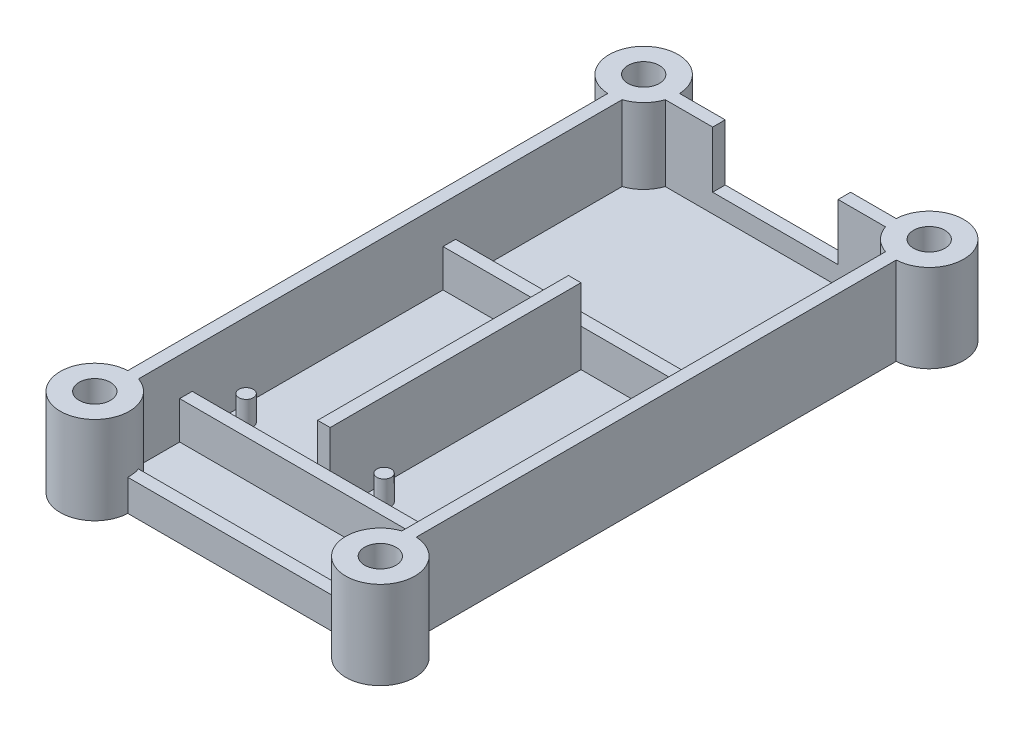
from build123d import *

# Parameters (mm, degrees)
SKETCH1_R              = 6.985
SKETCH1_R_2            = 3.175
SKETCH1_W              = 2.54
SKETCH1_H              = 50.8
BOSS_EXTRUDE1_DEPTH    = 17.78
SKETCH25_W             = 25.4
SKETCH25_H             = 50.8
SKETCH25_R             = 1.4605
BOSS_EXTRUDE10_DEPTH   = 2.54
BOSS_EXTRUDE10_2_DEPTH = 2.54
BOSS_EXTRUDE10_3_DEPTH = 2.54
BOSS_EXTRUDE10_4_DEPTH = 2.54
SKETCH16_R             = 1.4605
BOSS_EXTRUDE8_DEPTH    = 7.62
BOSS_EXTRUDE8_2_DEPTH  = 7.62
BOSS_EXTRUDE8_3_DEPTH  = 7.62
BOSS_EXTRUDE8_4_DEPTH  = 7.62
SKETCH17_W             = 53.34
SKETCH17_H             = 2.54
BOSS_EXTRUDE9_DEPTH    = 10.16
BOSS_EXTRUDE9_2_DEPTH  = 10.16
BOSS_EXTRUDE11_DEPTH   = 6.35
SKETCH20_W             = 25.4
SKETCH20_H             = 11.43
CUT_EXTRUDE7_DEPTH     = 2.54


with BuildPart() as part:
    # Sketch1 → Boss-Extrude1 (new body)
    # profile 1 of 12: a face of its own
    with BuildSketch(Plane(origin=(0, 0, 0), x_dir=(1, 0, 0), z_dir=(0, 1, 0))):
        with Locations((-28.91506403, -42.88506403)):
            Circle(SKETCH1_R)
        with Locations(Location((-28.91506403, -42.88506403, 0), (0, 0, 270))):
            Circle(SKETCH1_R_2, mode=Mode.SUBTRACT)
    # profile 2 of 12: a face of its own
    with BuildSketch(Plane(origin=(0, 0, 0), x_dir=(1, 0, 0), z_dir=(0, 1, 0))):
        with BuildLine():
            Line((-26.67, -36.270692367), (-26.67, -27.94))
            Line((-26.67, -27.94), (-29.21, -27.94))
            Line((-29.21, -27.94), (-29.21, -35.906293524))
            ThreePointArc((-29.21, -35.906293524), (-27.92312326, -35.970855579), (-26.67, -36.270692367))
        make_face()
    # profile 3 of 12: a face of its own
    with BuildSketch(Plane(origin=(0, 0, 0), x_dir=(1, 0, 0), z_dir=(0, 1, 0))):
        Polygon((-26.67, -27.94), (-26.67, -25.4), (-26.67, 25.4), (-26.67, 27.94), (-29.21, 27.94), (-29.21, -27.94), align=None)
    # profile 4 of 12: a face of its own
    with BuildSketch(Plane(origin=(0, 0, 0), x_dir=(1, 0, 0), z_dir=(0, 1, 0))):
        Polygon((26.67, -25.4), (26.67, -27.94), (29.21, -27.94), (29.21, 27.94), (26.67, 27.94), (26.67, 25.4), align=None)
    # profile 5 of 12: a face of its own
    with BuildSketch(Plane(origin=(0, 0, 0), x_dir=(1, 0, 0), z_dir=(0, 1, 0))):
        with BuildLine():
            Line((29.21, -27.94), (26.67, -27.94))
            Line((26.67, -27.94), (26.67, -36.270692367))
            ThreePointArc((26.67, -36.270692367), (27.92312326, -35.970855579), (29.21, -35.906293524))
            Line((29.21, -35.906293524), (29.21, -27.94))
        make_face()
    # profile 6 of 12: a face of its own
    with BuildSketch(Plane(origin=(0, 0, 0), x_dir=(1, 0, 0), z_dir=(0, 1, 0))):
        with Locations((28.91506403, -42.88506403)):
            Circle(SKETCH1_R)
        with Locations(Location((28.91506403, -42.88506403, 0), (0, 0, 270))):
            Circle(SKETCH1_R_2, mode=Mode.SUBTRACT)
    # profile 7 of 12: a face of its own
    with BuildSketch(Plane(origin=(0, 0, 0), x_dir=(1, 0, 0), z_dir=(0, 1, 0))):
        with BuildLine():
            Line((-29.21, 27.94), (-26.67, 27.94))
            Line((-26.67, 27.94), (-26.67, 61.670692367))
            ThreePointArc((-26.67, 61.670692367), (-27.92312326, 61.370855579), (-29.21, 61.306293524))
            Line((-29.21, 61.306293524), (-29.21, 27.94))
        make_face()
    # profile 8 of 12: a face of its own
    with BuildSketch(Plane(origin=(0, 0, 0), x_dir=(1, 0, 0), z_dir=(0, 1, 0))):
        with BuildLine():
            Line((26.67, 61.670692367), (26.67, 27.94))
            Line((26.67, 27.94), (29.21, 27.94))
            Line((29.21, 27.94), (29.21, 61.306293524))
            ThreePointArc((29.21, 61.306293524), (27.92312326, 61.370855579), (26.67, 61.670692367))
        make_face()
    # profile 9 of 12: a face of its own
    with BuildSketch(Plane(origin=(0, 0, 0), x_dir=(1, 0, 0), z_dir=(0, 1, 0))):
        with Locations((-28.91506403, 68.28506403)):
            Circle(SKETCH1_R)
        with Locations(Location((-28.91506403, 68.28506403, 0), (0, 0, 270))):
            Circle(SKETCH1_R_2, mode=Mode.SUBTRACT)
    # profile 10 of 12: a face of its own
    with BuildSketch(Plane(origin=(0, 0, 0), x_dir=(1, 0, 0), z_dir=(0, 1, 0))):
        with BuildLine():
            ThreePointArc((-21.93006403, 68.28506403), (-22.023343959, 67.147338463), (-22.300692367, 66.04))
            Line((-22.300692367, 66.04), (22.300692367, 66.04))
            ThreePointArc((22.300692367, 66.04), (22.000855579, 67.29312326), (21.936293524, 68.58))
            Line((21.936293524, 68.58), (-21.936293524, 68.58))
            ThreePointArc((-21.936293524, 68.58), (-21.931621577, 68.432564906), (-21.93006403, 68.28506403))
        make_face()
    # profile 11 of 12: a face of its own
    with BuildSketch(Plane(origin=(0, 0, 0), x_dir=(1, 0, 0), z_dir=(0, 1, 0))):
        with Locations((28.91506403, 68.28506403)):
            Circle(SKETCH1_R)
        with Locations(Location((28.91506403, 68.28506403, 0), (0, 0, 270))):
            Circle(SKETCH1_R_2, mode=Mode.SUBTRACT)
    # profile 12 of 12: a face of its own
    with BuildSketch(Plane(origin=(0, 0, 0), x_dir=(1, 0, 0), z_dir=(0, 1, 0))):
        Rectangle(SKETCH1_W, SKETCH1_H)
    extrude(amount=BOSS_EXTRUDE1_DEPTH)



with BuildPart() as body_2:
    # Sketch25 → Boss-Extrude10 (new body)
    with BuildSketch(Plane(origin=(0, 0, 0), x_dir=(1, 0, 0), z_dir=(0, 1, 0))):
        with Locations((-13.97, 0)):
            Rectangle(SKETCH25_W, SKETCH25_H)
        with Locations(Location((-4.6736, 16.637, 0), (0, 0, 270))):
            Circle(SKETCH25_R, mode=Mode.SUBTRACT)
        with Locations(Location((-23.368, -17.78, 0), (0, 0, 270))):
            Circle(SKETCH25_R, mode=Mode.SUBTRACT)
    extrude(amount=BOSS_EXTRUDE10_DEPTH)


with BuildPart() as body_3:
    # Sketch25 → Boss-Extrude10 2 (new body)
    with BuildSketch(Plane(origin=(0, 0, 0), x_dir=(1, 0, 0), z_dir=(0, 1, 0))):
        with Locations((13.97, 0)):
            Rectangle(SKETCH25_W, SKETCH25_H)
        with Locations(Location((4.572, -17.78, 0), (0, 0, 270))):
            Circle(SKETCH25_R, mode=Mode.SUBTRACT)
        with Locations(Location((23.2664, 16.637, 0), (0, 0, 270))):
            Circle(SKETCH25_R, mode=Mode.SUBTRACT)
    extrude(amount=BOSS_EXTRUDE10_2_DEPTH)


with BuildPart() as body_4:
    # Sketch25 → Boss-Extrude10 3 (new body)
    with BuildSketch(Plane(origin=(0, 0, 0), x_dir=(1, 0, 0), z_dir=(0, 1, 0))):
        with BuildLine():
            Line((-26.67, 27.94), (26.67, 27.94))
            Line((26.67, 27.94), (26.67, 61.670692367))
            ThreePointArc((26.67, 61.670692367), (23.975923164, 63.345923164), (22.300692367, 66.04))
            Line((22.300692367, 66.04), (-22.300692367, 66.04))
            ThreePointArc((-22.300692367, 66.04), (-23.975923164, 63.345923164), (-26.67, 61.670692367))
            Line((-26.67, 61.670692367), (-26.67, 27.94))
        make_face()
    extrude(amount=BOSS_EXTRUDE10_3_DEPTH)


with BuildPart() as body_5:
    # Sketch25 → Boss-Extrude10 4 (new body)
    with BuildSketch(Plane(origin=(0, 0, 0), x_dir=(1, 0, 0), z_dir=(0, 1, 0))):
        with BuildLine():
            Line((26.67, -36.270692367), (26.67, -27.94))
            Line((26.67, -27.94), (-26.67, -27.94))
            Line((-26.67, -27.94), (-26.67, -36.270692367))
            ThreePointArc((-26.67, -36.270692367), (-23.975923164, -37.945923164), (-22.300692367, -40.64))
            Line((-22.300692367, -40.64), (22.300692367, -40.64))
            ThreePointArc((22.300692367, -40.64), (23.975923164, -37.945923164), (26.67, -36.270692367))
        make_face()
    extrude(amount=BOSS_EXTRUDE10_4_DEPTH)


with BuildPart() as body_6:
    # Sketch16 → Boss-Extrude8 (new body)
    with BuildSketch(Plane(origin=(0, 0, 0), x_dir=(1, 0, 0), z_dir=(0, 1, 0))):
        with Locations(Location((-4.6736, 16.637, 0), (0, 0, 90))):
            Circle(SKETCH16_R)
    extrude(amount=BOSS_EXTRUDE8_DEPTH)


with BuildPart() as body_7:
    # Sketch16 → Boss-Extrude8 2 (new body)
    with BuildSketch(Plane(origin=(0, 0, 0), x_dir=(1, 0, 0), z_dir=(0, 1, 0))):
        with Locations(Location((-23.368, -17.78, 0), (0, 0, 90))):
            Circle(SKETCH16_R)
    extrude(amount=BOSS_EXTRUDE8_2_DEPTH)


with BuildPart() as body_8:
    # Sketch16 → Boss-Extrude8 3 (new body)
    with BuildSketch(Plane(origin=(0, 0, 0), x_dir=(1, 0, 0), z_dir=(0, 1, 0))):
        with Locations(Location((4.572, -17.78, 0), (0, 0, 90))):
            Circle(SKETCH16_R)
    extrude(amount=BOSS_EXTRUDE8_3_DEPTH)


with BuildPart() as body_9:
    # Sketch16 → Boss-Extrude8 4 (new body)
    with BuildSketch(Plane(origin=(0, 0, 0), x_dir=(1, 0, 0), z_dir=(0, 1, 0))):
        with Locations(Location((23.2664, 16.637, 0), (0, 0, 90))):
            Circle(SKETCH16_R)
    extrude(amount=BOSS_EXTRUDE8_4_DEPTH)


with BuildPart() as body_10:
    # Sketch17 → Boss-Extrude9 (new body)
    with BuildSketch(Plane(origin=(0, 0, 0), x_dir=(1, 0, 0), z_dir=(0, 1, 0))):
        with Locations((0, -26.67)):
            Rectangle(SKETCH17_W, SKETCH17_H)
    extrude(amount=BOSS_EXTRUDE9_DEPTH)


with BuildPart() as body_11:
    # Sketch17 → Boss-Extrude9 2 (new body)
    with BuildSketch(Plane(origin=(0, 0, 0), x_dir=(1, 0, 0), z_dir=(0, 1, 0))):
        with Locations((0, 26.67)):
            Rectangle(SKETCH17_W, SKETCH17_H)
    extrude(amount=BOSS_EXTRUDE9_2_DEPTH)


with BuildPart() as part_1:
    add(part.part)

    add(body_5.part)  # Boss-Extrude11 merges body 5
    # Sketch27 → Boss-Extrude11 (add)
    with BuildSketch(Plane(origin=(0, 0, 0), x_dir=(1, 0, 0), z_dir=(0, 1, 0))):
        with BuildLine():
            Line((22.300692367, -40.64), (-22.300692367, -40.64))
            ThreePointArc((-22.300692367, -40.64), (-22.023343959, -41.747338463), (-21.93006403, -42.88506403))
            ThreePointArc((-21.93006403, -42.88506403), (-21.931621577, -43.032564906), (-21.936293524, -43.18))
            Line((-21.936293524, -43.18), (21.936293524, -43.18))
            ThreePointArc((21.936293524, -43.18), (22.000855579, -41.89312326), (22.300692367, -40.64))
        make_face()
    extrude(amount=BOSS_EXTRUDE11_DEPTH)

    # Sketch20 → Cut-Extrude7 (cut)
    with BuildSketch(Plane(origin=(0, 0, -68.58), x_dir=(-1, 0, 0), z_dir=(0, 0, -1))):
        with Locations((0, 12.065)):
            Rectangle(SKETCH20_W, SKETCH20_H)
    extrude(amount=-CUT_EXTRUDE7_DEPTH, mode=Mode.SUBTRACT)


solid = Compound([body_2.part, body_3.part, body_4.part, body_6.part, body_7.part, body_8.part, body_9.part, body_10.part, body_11.part, part_1.part])
